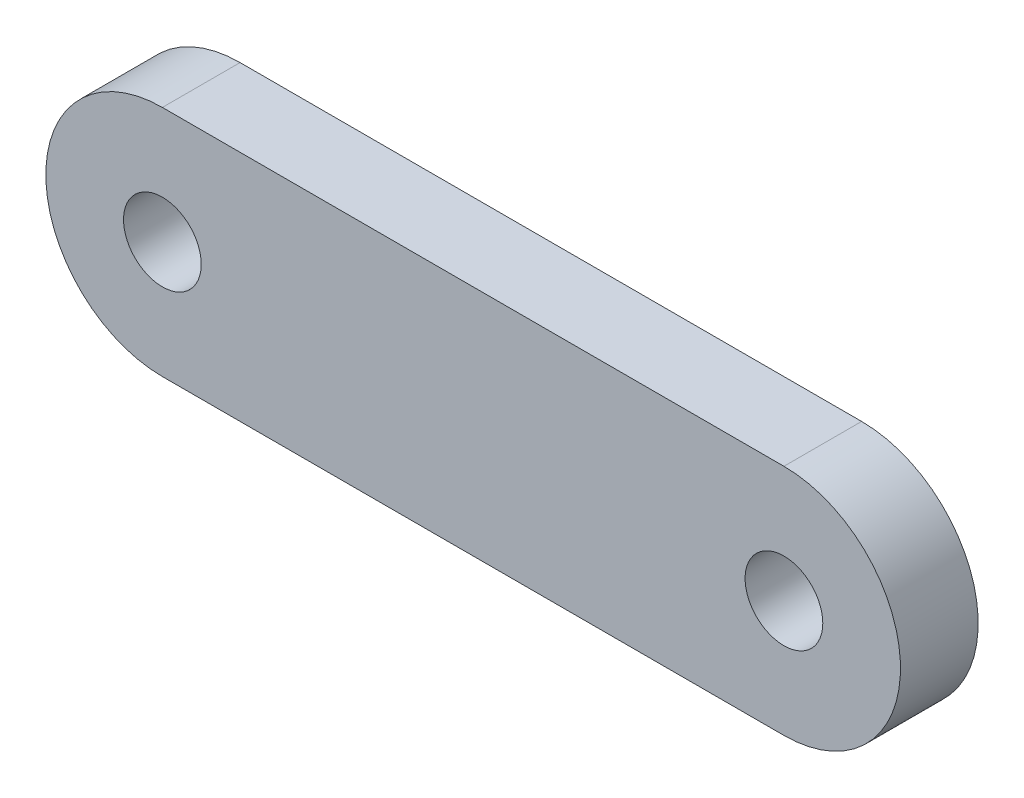
from build123d import *

# Parameters (mm, degrees)
SKETCH2_R           = 0.5
BOSS_EXTRUDE1_DEPTH = 1


with BuildPart() as part:
    # Sketch2 → Boss-Extrude1 (new body)
    with BuildSketch(Plane.XY):
        with BuildLine():
            Line((-5.163544054, 1.5), (2.836455946, 1.5))
            ThreePointArc((2.836455946, 1.5), (4.336455946, 0), (2.836455946, -1.5))
            Line((2.836455946, -1.5), (-5.163544054, -1.5))
            ThreePointArc((-5.163544054, -1.5), (-6.663544054, 0), (-5.163544054, 1.5))
        make_face()
        with Locations((2.836455946, 0)):
            Circle(SKETCH2_R, mode=Mode.SUBTRACT)
        with Locations((-5.163544054, 0)):
            Circle(SKETCH2_R, mode=Mode.SUBTRACT)
    extrude(amount=BOSS_EXTRUDE1_DEPTH)


solid = part.part
